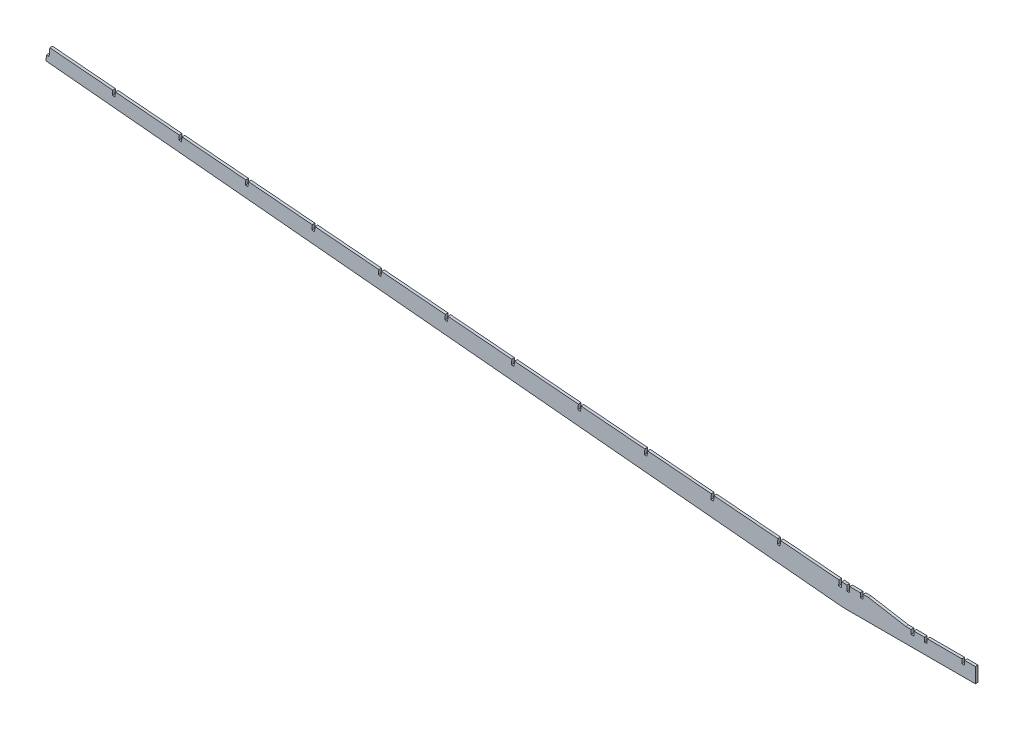
from build123d import *

# Parameters (mm, degrees)
BOSS_EXTRUDE1_DEPTH = 3.175
CUT_EXTRUDE1_DEPTH  = 955.350997373


with BuildPart() as part:
    # Sketch1 → Boss-Extrude1 (new body)
    with BuildSketch(Plane.XY):
        Polygon((-950.530495659, 69.619322302), (-951.061849964, 63.291592645), (-11.536706102, -24.902638492), (-8.372841274, -25.168315645), (0, -25.545856054), (152.4, -25.545856054), (152.4, -7.765856054), (139.7, -7.765856054), (139.7, -12.845856054), (136.525, -12.845856054), (136.525, -7.765856054), (95.25, -7.765856054), (95.25, -12.845856054), (92.075, -12.845856054), (92.075, -7.765856054), (79.375, -7.765856054), (79.375, -12.845856054), (76.2, -12.845856054), (76.2, -7.765856054), (69.85, -7.765856054), (25.4, -0.145856054), (19.05, -0.145856054), (19.05, -5.225856054), (15.875, -5.225856054), (15.875, -0.145856054), (3.175, -0.145856054), (3.175, -6.495856054), (0, -6.495856054), (0, -0.145856054), (-2.81225704, -0.145856054), (-6.247424053, 0.14260298), (-6.778778359, -6.185126677), (-9.942643187, -5.919449524), (-9.411288881, 0.408280132), (-946.54805097, 79.101852726), (-947.366630831, 69.353645149), align=None)
    extrude(amount=BOSS_EXTRUDE1_DEPTH)

    # Sketch2 → Cut-Extrude1 (cut, through all)
    with BuildSketch(Plane.XY.offset(3.175)):
        Polygon((-869.047169109, 67.116306724), (-868.590421605, 72.555567687), (-871.754286433, 72.821244839), (-872.210759203, 67.385255598), align=None)
        Polygon((-790.083960364, 60.403342827), (-789.620355495, 65.924265958), (-792.784220323, 66.189943111), (-793.247550458, 60.672291701), align=None)
        Polygon((-711.120751618, 53.69037893), (-710.650289385, 59.29296423), (-713.814154213, 59.558641383), (-714.284341712, 53.959327804), align=None)
        Polygon((-632.157542872, 46.977415032), (-631.680223276, 52.661662502), (-634.844088104, 52.927339654), (-635.321132966, 47.246363906), align=None)
        Polygon((-553.194334126, 40.264451135), (-552.710157166, 46.030360773), (-555.874021994, 46.296037926), (-556.35792422, 40.533400009), align=None)
        Polygon((-474.23112538, 33.551487238), (-473.740091056, 39.399059045), (-476.903955884, 39.664736197), (-477.394715474, 33.820436112), align=None)
        Polygon((-395.267916634, 26.83852334), (-394.770024946, 32.767757316), (-397.933889774, 33.033434469), (-398.431506728, 27.107472214), align=None)
        Polygon((-316.304707888, 20.125559443), (-315.799958836, 26.136455588), (-318.963823664, 26.402132741), (-319.468297982, 20.394508317), align=None)
        Polygon((-237.341499142, 13.412595546), (-236.829892727, 19.50515386), (-239.993757555, 19.770831012), (-240.505089236, 13.68154442), align=None)
        Polygon((-158.378290396, 6.699631648), (-157.859826617, 12.873852131), (-161.023691445, 13.139529284), (-161.54188049, 6.968580522), align=None)
        Polygon((-79.415081651, -0.013332249), (-78.889760507, 6.242550403), (-82.053625335, 6.508227555), (-82.578671745, 0.255616625), align=None)
    extrude(amount=-CUT_EXTRUDE1_DEPTH, mode=Mode.SUBTRACT)


solid = part.part
